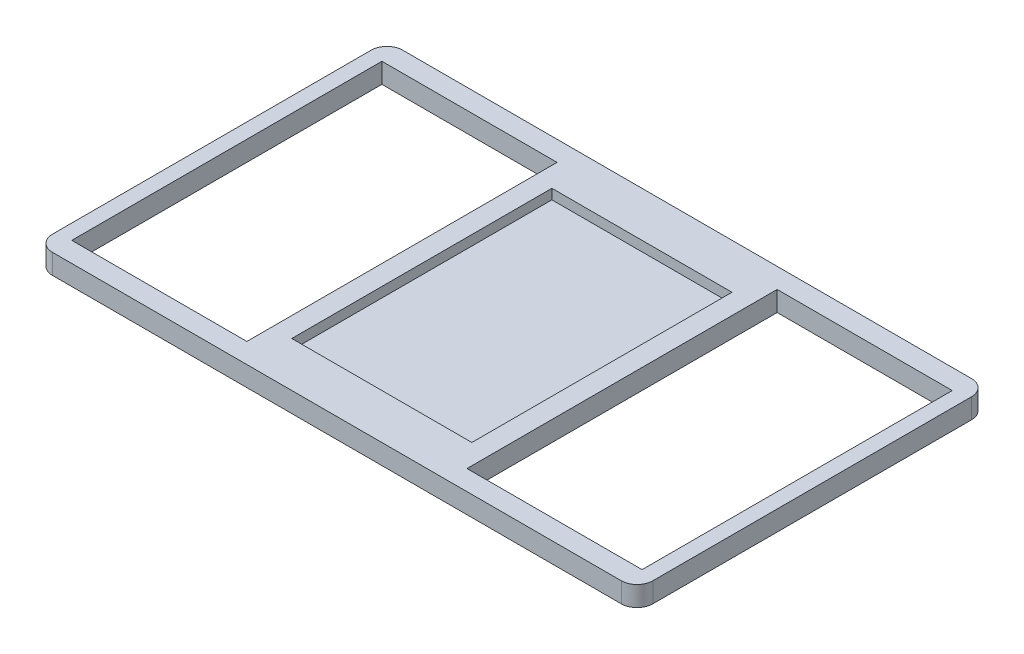
from build123d import *

# Parameters (mm, degrees)
SKETCH1_W           = 381
SKETCH1_H           = 222.25
BOSS_EXTRUDE1_DEPTH = 12.7
SKETCH2_W           = 111.125
SKETCH2_H           = 196.85
CUT_EXTRUDE1_DEPTH  = 12.7
SKETCH3_W           = 114.3
SKETCH3_H           = 165.1
CUT_EXTRUDE2_DEPTH  = 6.35
FILLET1_R           = 10


with BuildPart() as part:
    # Sketch1 → Boss-Extrude1 (new body)
    with BuildSketch(Plane(origin=(0, 0, 0), x_dir=(1, 0, 0), z_dir=(0, 1, 0))):
        with Locations((195.298920378, 111.125)):
            Rectangle(SKETCH1_W, SKETCH1_H)
    extrude(amount=BOSS_EXTRUDE1_DEPTH)

    # Sketch2 → Cut-Extrude1 (cut)
    with BuildSketch(Plane(origin=(0, 12.7, 0), x_dir=(1, 0, 0), z_dir=(0, 1, 0))):
        with Locations((69.886420378, 111.125)):
            Rectangle(SKETCH2_W, SKETCH2_H)
        with Locations((320.711420378, 111.125)):
            Rectangle(SKETCH2_W, SKETCH2_H)
    extrude(amount=-CUT_EXTRUDE1_DEPTH, mode=Mode.SUBTRACT)

    # Sketch3 → Cut-Extrude2 (cut)
    with BuildSketch(Plane(origin=(0, 12.7, 0), x_dir=(1, 0, 0), z_dir=(0, 1, 0))):
        with Locations((195.223394244, 111.125)):
            Rectangle(SKETCH3_W, SKETCH3_H)
    extrude(amount=-CUT_EXTRUDE2_DEPTH, mode=Mode.SUBTRACT)

    # Fillet1
    fillet1_edges = [part.edges().sort_by_distance(p)[0] for p in [
        (385.798920378, 6.35, -222.25),
        (385.798920378, 6.35, 0),
        (4.798920378, 6.35, 0),
        (4.798920378, 6.35, -222.25),
    ]]
    fillet(fillet1_edges, radius=FILLET1_R)


solid = part.part
